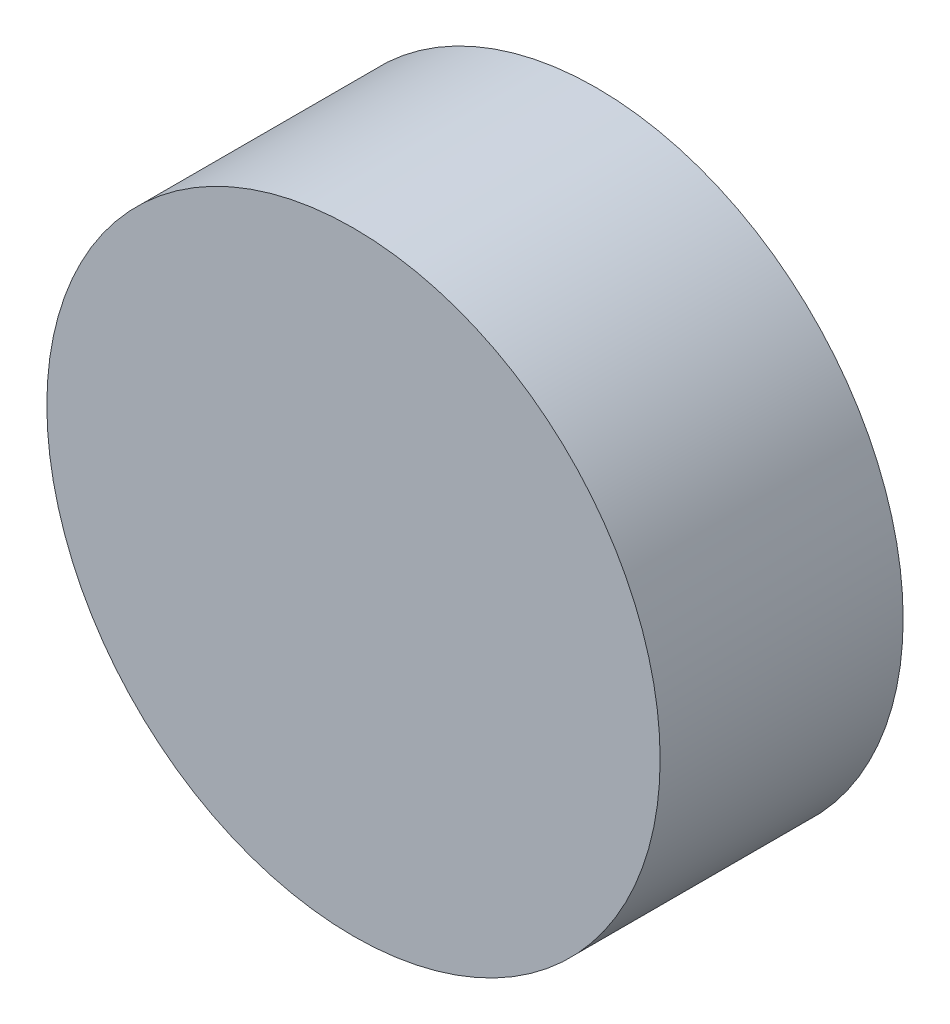
from build123d import *

# Parameters (mm, degrees)
SKETCH1_R           = 53
BOSS_EXTRUDE1_DEPTH = 42


with BuildPart() as part:
    # Sketch1 → Boss-Extrude1 (new body)
    with BuildSketch(Plane.XY):
        with Locations(Location((0, 0, 0), (0, 0, 180))):
            Circle(SKETCH1_R)
    extrude(amount=BOSS_EXTRUDE1_DEPTH)


solid = part.part
